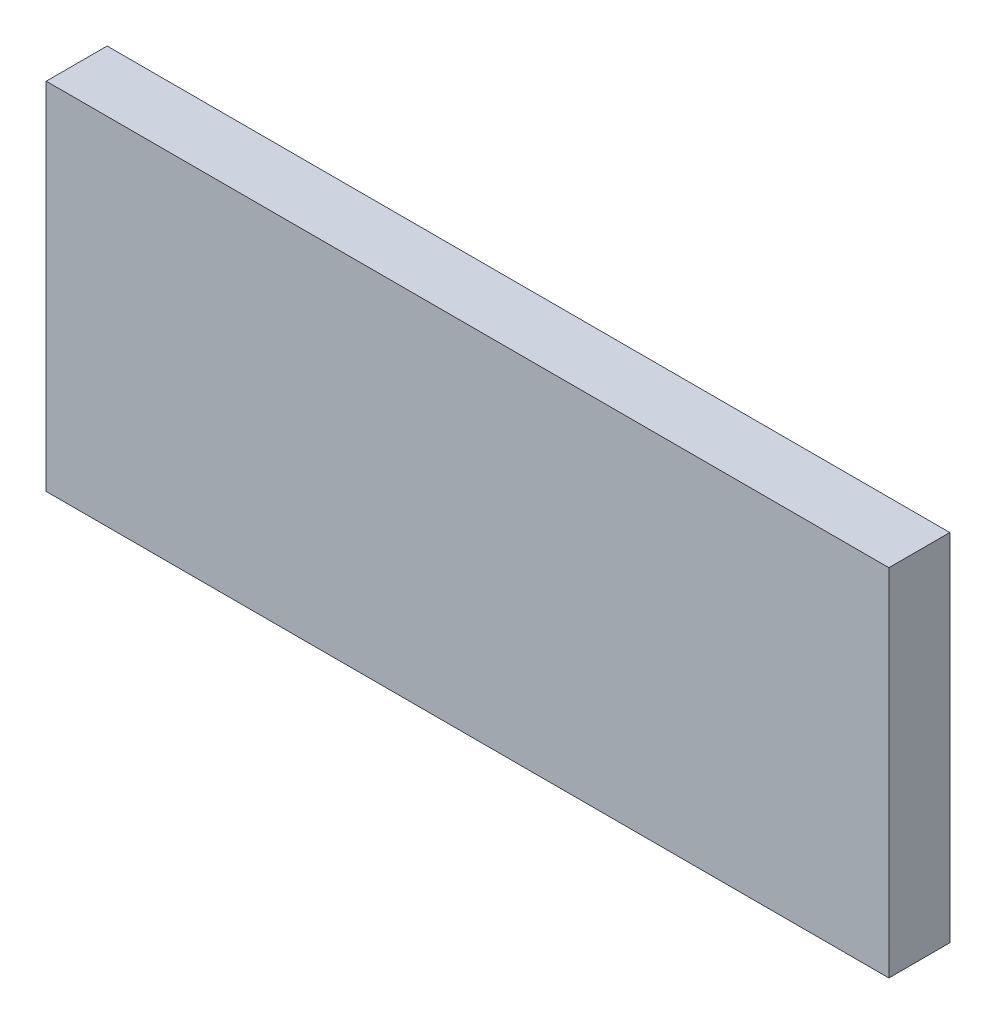
from build123d import *

# Parameters (mm, degrees)
SKETCH3_W           = 166
SKETCH3_H           = 70
BOSS_EXTRUDE2_DEPTH = 12


with BuildPart() as part:
    # Sketch3 → Boss-Extrude2 (new body)
    with BuildSketch(Plane.XY):
        with Locations((500, 35)):
            Rectangle(SKETCH3_W, SKETCH3_H)
    extrude(amount=BOSS_EXTRUDE2_DEPTH)


solid = part.part
